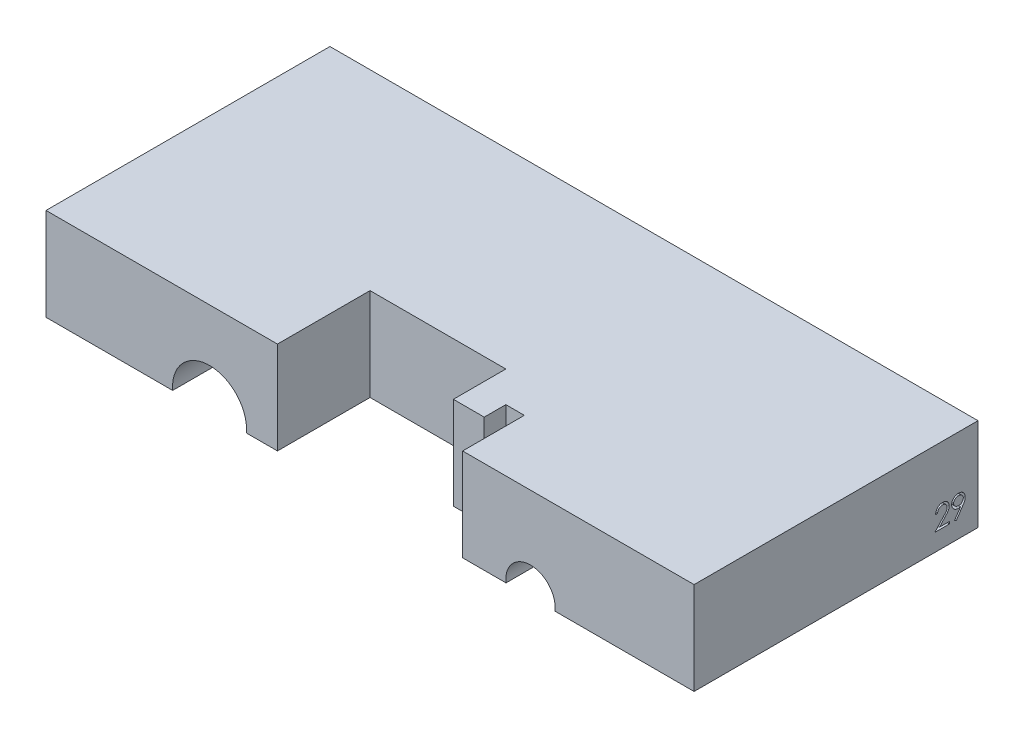
from build123d import *

# Parameters (mm, degrees)
SKETCH1_W               = 105
SKETCH1_H               = 92
BOSS_EXTRUDE1_DEPTH     = 15
SKETCH2_W               = 30
SKETCH2_H               = 30
CUT_EXTRUDE1_DEPTH      = 72
BOSS_EXTRUDE4_DEPTH     = 15
CUT_EXTRUDE2_DEPTH      = 84
CUT_EXTRUDE2_DEPTH_BACK = 64
SKETCH18_R              = 4
CUT_EXTRUDE3_DEPTH      = 10
CUT_EXTRUDE3_DEPTH_BACK = 10
SKETCH22_R              = 6
CUT_EXTRUDE4_DEPTH      = 10
CUT_EXTRUDE4_DEPTH_BACK = 10
SKETCH23_R              = 6
CUT_EXTRUDE5_DEPTH      = 10
CUT_EXTRUDE5_DEPTH_BACK = 10
SKETCH24_R              = 6
CUT_EXTRUDE7_DEPTH      = 2
CUT_EXTRUDE8_DEPTH      = 2
SKETCH30_W              = 105
SKETCH30_H              = 46
CUT_EXTRUDE10_DEPTH     = 40


with BuildPart() as part:
    # Sketch1 → Boss-Extrude1 (new body)
    with BuildSketch(Plane(origin=(0, 0, 0), x_dir=(1, 0, 0), z_dir=(0, 1, 0))):
        with Locations((52.5, 46)):
            Rectangle(SKETCH1_W, SKETCH1_H)
    extrude(amount=BOSS_EXTRUDE1_DEPTH)

    # Sketch2 → Cut-Extrude1 (cut)
    with BuildSketch(Plane(origin=(0, 15, 0), x_dir=(1, 0, 0), z_dir=(0, 1, 0))):
        with Locations((52.5, 46)):
            Rectangle(SKETCH2_W, SKETCH2_H)
    extrude(amount=-CUT_EXTRUDE1_DEPTH, mode=Mode.SUBTRACT)

    # Sketch15 → Boss-Extrude4 (add)
    with BuildSketch(Plane(origin=(0, 15, 0), x_dir=(1, 0, 0), z_dir=(0, 1, 0))):
        Polygon((72.5, 67), (72.5, 46), (72.5, 25), (59.5, 25), (59.5, 31), (59.5, 39.5), (64.5, 39.5), (64.5, 36), (67.5, 36), (67.5, 46), (67.5, 56), (64.5, 56), (64.5, 52.5), (59.5, 52.5), (59.5, 61), (59.5, 67), align=None)
    extrude(amount=-BOSS_EXTRUDE4_DEPTH)

    # Sketch18 → Cut-Extrude2 (cut, two sides: drawn at the far end of the back side and taken through both)
    with BuildSketch(Plane.XY.offset(-46).offset(-CUT_EXTRUDE2_DEPTH_BACK)):
        with Locations((26.5, 0.5)):
            Circle(SKETCH18_R)
        with Locations((78.5, 0.5)):
            Circle(SKETCH18_R)
    extrude(amount=CUT_EXTRUDE2_DEPTH + CUT_EXTRUDE2_DEPTH_BACK, mode=Mode.SUBTRACT)

    # Sketch22 → Cut-Extrude3 (cut, two sides: drawn at the far end of the back side and taken through both)
    with BuildSketch(Plane.XY.offset(-46).offset(-CUT_EXTRUDE3_DEPTH_BACK)):
        with Locations((26.5, 0.5)):
            Circle(SKETCH22_R)
    extrude(amount=CUT_EXTRUDE3_DEPTH + CUT_EXTRUDE3_DEPTH_BACK, mode=Mode.SUBTRACT)

    # Sketch23 → Cut-Extrude4 (cut, two sides: drawn at the far end of the back side and taken through both)
    with BuildSketch(Plane(origin=(0, 0, -69), x_dir=(-1, 0, 0), z_dir=(0, 0, -1)).offset(-CUT_EXTRUDE4_DEPTH_BACK)):
        with Locations((-78.5, 0.5)):
            Circle(SKETCH23_R)
    extrude(amount=CUT_EXTRUDE4_DEPTH + CUT_EXTRUDE4_DEPTH_BACK, mode=Mode.SUBTRACT)

    # Sketch24 → Cut-Extrude5 (cut, two sides: drawn at the far end of the back side and taken through both)
    with BuildSketch(Plane.XY.offset(-23).offset(-CUT_EXTRUDE5_DEPTH_BACK)):
        with Locations((78.5, 0.5)):
            Circle(SKETCH24_R)
    extrude(amount=CUT_EXTRUDE5_DEPTH + CUT_EXTRUDE5_DEPTH_BACK, mode=Mode.SUBTRACT)

    # Sketch27 → Cut-Extrude7 (cut)
    # profile 1 of 2: a face of its own
    with BuildSketch(Plane.ZY):
        with BuildLine():
            Line((-6.628929061, 4.581451926), (-6.943031625, 4.581451926))
            add(Edge.make_bspline(
                [(-6.943031625, 4.581451926), (-6.940984472, 4.623122814), (-6.936963918, 4.704963329), (-6.918135629, 4.824287235), (-6.891194752, 4.938342034), (-6.853103298, 5.046211948), (-6.80579702, 5.148850755), (-6.749066993, 5.245850771), (-6.681873142, 5.336841959), (-6.605666408, 5.420980803), (-6.522897769, 5.498168374), (-6.43359183, 5.564823616), (-6.339746802, 5.621141288), (-6.241647403, 5.66822253), (-6.13818684, 5.703562375), (-6.030303982, 5.729784015), (-5.917524846, 5.745560361), (-5.840684824, 5.747256146), (-5.801605343, 5.748118593)],
                knots=[0, 0, 0, 0, 1.10065271, 2.161652631, 3.183658789, 4.190468796, 5.17591951, 6.163126047, 7.15150782, 8.156236427, 9.156009102, 10.134482811, 11.092018607, 12.041330605, 13.001268258, 13.972401359, 14.968799086, 16, 16, 16, 16], degree=3))
            add(Edge.make_bspline(
                [(-5.801605343, 5.748118593), (-5.763227269, 5.747220137), (-5.687815725, 5.745454702), (-5.57775371, 5.730293673), (-5.472976416, 5.706548081), (-5.373688649, 5.673232665), (-5.280682585, 5.628448237), (-5.19325954, 5.574650699), (-5.110378729, 5.512430867), (-5.035771946, 5.439177054), (-4.967263866, 5.360974669), (-4.908161611, 5.277486766), (-4.857548448, 5.19125748), (-4.815360768, 5.101629278), (-4.784304629, 5.00775825), (-4.760726421, 4.911011047), (-4.747399007, 4.810386236), (-4.745353584, 4.74227968), (-4.744313677, 4.707653849)],
                knots=[0, 0, 0, 0, 1.111607364, 2.184268762, 3.212621178, 4.221274766, 5.211760367, 6.196651075, 7.1921475, 8.207485113, 9.220403448, 10.201281604, 11.166441695, 12.114753415, 13.065576456, 14.026450734, 14.996634279, 16, 16, 16, 16], degree=3))
            add(Edge.make_bspline(
                [(-4.744313677, 4.707653849), (-4.74600694, 4.658906015), (-4.749363751, 4.562265801), (-4.778078128, 4.420250938), (-4.822924639, 4.282657519), (-4.876921995, 4.171920217), (-4.93139444, 4.082686724), (-4.980481947, 4.009218019), (-5.037946758, 3.93011255), (-5.104625256, 3.845635213), (-5.179138128, 3.755124308), (-5.262160292, 3.658634512), (-5.354283774, 3.557162743), (-5.418942274, 3.487857141), (-5.45244669, 3.451944715)],
                knots=[0, 0, 0, 0, 1.184426356, 2.348067706, 3.509069118, 4.696110526, 5.333549288, 6.050745305, 6.844228056, 7.710549037, 8.667450064, 9.695053472, 10.805634456, 12, 12, 12, 12], degree=3))
            Line((-5.45244669, 3.451944715), (-6.328147811, 2.517349362))
            Line((-6.328147811, 2.517349362), (-4.699441882, 2.517349362))
            Line((-4.699441882, 2.517349362), (-4.699441882, 2.158375003))
            Line((-4.699441882, 2.158375003), (-7.07764701, 2.158375003))
            Line((-7.07764701, 2.158375003), (-5.720275215, 3.606892632))
            add(Edge.make_bspline(
                [(-5.720275215, 3.606892632), (-5.687227328, 3.641390938), (-5.623749101, 3.707655125), (-5.533966524, 3.804398085), (-5.453327536, 3.894147626), (-5.381310143, 3.976734174), (-5.319476638, 4.053365742), (-5.264604406, 4.121560445), (-5.220638815, 4.184314896), (-5.172923419, 4.25705551), (-5.126709438, 4.345867827), (-5.086997082, 4.454401516), (-5.062782234, 4.566128769), (-5.059877398, 4.641630806), (-5.058416241, 4.679608978)],
                knots=[0, 0, 0, 0, 1.329631726, 2.553950428, 3.673215718, 4.687767853, 5.603093632, 6.413772471, 7.123043292, 7.734684054, 8.834405432, 9.900288307, 10.943827018, 12, 12, 12, 12], degree=3))
            add(Edge.make_bspline(
                [(-5.058416241, 4.679608978), (-5.059051983, 4.703490376), (-5.060304909, 4.750556026), (-5.071362607, 4.819561785), (-5.088073113, 4.886126599), (-5.112018371, 4.950455218), (-5.143625111, 5.01190087), (-5.182098491, 5.070538351), (-5.226488554, 5.127227316), (-5.277839824, 5.180380614), (-5.334251343, 5.229061819), (-5.393845593, 5.272185905), (-5.456895697, 5.308225016), (-5.523135819, 5.337768513), (-5.592381289, 5.360943894), (-5.664766034, 5.377002473), (-5.74009005, 5.387084957), (-5.791523546, 5.388449129), (-5.817731145, 5.389144234)],
                knots=[0, 0, 0, 0, 0.991446411, 1.95395049, 2.89581595, 3.838931463, 4.798493298, 5.75982156, 6.748411868, 7.785213223, 8.824556874, 9.840280684, 10.836137867, 11.835679398, 12.848801643, 13.863922112, 14.911575587, 16, 16, 16, 16], degree=3))
            add(Edge.make_bspline(
                [(-5.817731145, 5.389144234), (-5.845101977, 5.388429202), (-5.898853774, 5.387024997), (-5.977772807, 5.377202333), (-6.053058584, 5.360256492), (-6.124900487, 5.337079818), (-6.193420073, 5.307621269), (-6.258284117, 5.270929524), (-6.319347006, 5.227146031), (-6.37672353, 5.177505475), (-6.429587509, 5.122237874), (-6.476034384, 5.06062791), (-6.516618399, 4.993800495), (-6.552027632, 4.921935945), (-6.580783322, 4.844382165), (-6.602756473, 4.76141446), (-6.620143319, 4.673393078), (-6.62595184, 4.612607993), (-6.628929061, 4.581451926)],
                knots=[0, 0, 0, 0, 1.031018746, 2.02475058, 2.990194455, 3.934040569, 4.864654155, 5.795059489, 6.735614925, 7.690564532, 8.649604399, 9.611025574, 10.590972636, 11.591080095, 12.624614302, 13.701020113, 14.821632451, 16, 16, 16, 16], degree=3))
        make_face()
    # profile 2 of 2: a face of its own
    with BuildSketch(Plane.ZY):
        with BuildLine():
            Line((-3.622518805, 2.068631414), (-3.873520408, 2.24321074))
            Line((-3.873520408, 2.24321074), (-2.900363356, 3.665786862))
            add(Edge.make_bspline(
                [(-2.900363356, 3.665786862), (-2.962454092, 3.658193799), (-3.084714212, 3.643242634), (-3.207851314, 3.640495979), (-3.268452299, 3.639144234)],
                knots=[0, 0, 0, 0, 1.015715272, 2, 2, 2, 2], degree=3))
            add(Edge.make_bspline(
                [(-3.268452299, 3.639144234), (-3.305194346, 3.640085311), (-3.377315773, 3.641932561), (-3.483347426, 3.65657437), (-3.585232986, 3.679124497), (-3.682702342, 3.712773252), (-3.776121847, 3.754591461), (-3.86528756, 3.806448475), (-3.950079451, 3.867454767), (-4.029586861, 3.937287758), (-4.1018986, 4.013965811), (-4.166321898, 4.095121454), (-4.21986303, 4.181697424), (-4.264339615, 4.271927644), (-4.298070068, 4.367108995), (-4.322632606, 4.466158395), (-4.33775496, 4.569770037), (-4.339554056, 4.640295168), (-4.340467523, 4.676103369)],
                knots=[0, 0, 0, 0, 1.060718605, 2.082097864, 3.085795603, 4.069760067, 5.054557537, 6.03741023, 7.043284206, 8.066802108, 9.088538119, 10.083643548, 11.053783639, 12.022749082, 12.983451788, 13.964007469, 14.966251758, 16, 16, 16, 16], degree=3))
            add(Edge.make_bspline(
                [(-4.340467523, 4.676103369), (-4.338733088, 4.725072021), (-4.335328744, 4.821187553), (-4.307930227, 4.961621322), (-4.262869888, 5.094407866), (-4.200041511, 5.21919806), (-4.12090679, 5.334196799), (-4.0257982, 5.437805408), (-3.915294235, 5.528550262), (-3.791912216, 5.606554339), (-3.658559195, 5.669289336), (-3.518890537, 5.715528637), (-3.373976417, 5.742727385), (-3.275808747, 5.746313246), (-3.226384991, 5.748118593)],
                knots=[0, 0, 0, 0, 1.022988612, 2.007919123, 2.978103895, 3.94594894, 4.918897164, 5.887013414, 6.875921846, 7.89917871, 8.930658928, 9.948724884, 10.967259574, 12, 12, 12, 12], degree=3))
            add(Edge.make_bspline(
                [(-3.226384991, 5.748118593), (-3.177896571, 5.74628843), (-3.082088024, 5.7426722), (-2.941199018, 5.716188231), (-2.806258001, 5.671551558), (-2.678013014, 5.609866995), (-2.559273602, 5.532546087), (-2.452497791, 5.440411563), (-2.360122252, 5.333406036), (-2.282298371, 5.214117546), (-2.219828331, 5.085950565), (-2.174756048, 4.952166642), (-2.147010409, 4.813727921), (-2.143514082, 4.719933447), (-2.141749574, 4.67259776)],
                knots=[0, 0, 0, 0, 1.026385292, 2.028040595, 3.023318987, 4.028184125, 5.03290303, 6.015178782, 7.004435299, 8.016004309, 9.023023918, 10.015172535, 10.998308025, 12, 12, 12, 12], degree=3))
            add(Edge.make_bspline(
                [(-2.141749574, 4.67259776), (-2.142927983, 4.635853993), (-2.145318091, 4.561328452), (-2.162054398, 4.448098109), (-2.190474583, 4.33264688), (-2.222726282, 4.234925284), (-2.25385845, 4.154216834), (-2.283159581, 4.090465254), (-2.315671735, 4.023363991), (-2.3535905, 3.953616653), (-2.394352797, 3.880334118), (-2.440412074, 3.804251402), (-2.490717645, 3.725266409), (-2.526547365, 3.672019321), (-2.544894606, 3.644753208)],
                knots=[0, 0, 0, 0, 1.179839688, 2.393009684, 3.667231171, 4.993948276, 5.694988576, 6.444077775, 7.246288328, 8.089075292, 8.993003841, 9.939041771, 10.944649915, 12, 12, 12, 12], degree=3))
            Line((-2.544894606, 3.644753208), (-3.622518805, 2.068631414))
        make_face()
        with BuildLine():
            add(Edge.make_bspline(
                [(-3.21025919, 3.998118593), (-3.182425175, 3.998878977), (-3.128241812, 4.000359186), (-3.048864513, 4.009368427), (-2.97394031, 4.025342414), (-2.903269061, 4.048262126), (-2.836142159, 4.075918794), (-2.773625831, 4.111130781), (-2.715667755, 4.153147415), (-2.661879828, 4.200357431), (-2.614115829, 4.252808015), (-2.571572798, 4.307705121), (-2.53541223, 4.365289731), (-2.506848953, 4.426282994), (-2.483364378, 4.489200202), (-2.467146366, 4.555054557), (-2.458162033, 4.623502958), (-2.456630458, 4.670001616), (-2.455852138, 4.693631414)],
                knots=[0, 0, 0, 0, 1.163407946, 2.26475976, 3.333800367, 4.359385343, 5.366239384, 6.363380779, 7.350133999, 8.353570782, 9.349036268, 10.310270964, 11.253520213, 12.184142, 13.120487599, 14.056272588, 15.012232024, 16, 16, 16, 16], degree=3))
            add(Edge.make_bspline(
                [(-2.455852138, 4.693631414), (-2.456521807, 4.717271079), (-2.457841473, 4.763855939), (-2.468428772, 4.832405679), (-2.487053996, 4.898098939), (-2.51204448, 4.961295369), (-2.544964718, 5.021475741), (-2.584468204, 5.079395613), (-2.631400654, 5.134687741), (-2.68540322, 5.186051724), (-2.743637773, 5.233399624), (-2.805698273, 5.2751857), (-2.871073189, 5.310206896), (-2.939363679, 5.339105866), (-3.010712028, 5.361657642), (-3.085076016, 5.377875006), (-3.162831422, 5.386846761), (-3.215612708, 5.388368655), (-3.242510792, 5.389144234)],
                knots=[0, 0, 0, 0, 0.972161553, 1.915763587, 2.844109794, 3.775983486, 4.705125789, 5.659731448, 6.655561913, 7.682237399, 8.721216875, 9.739758359, 10.754845918, 11.767244016, 12.7857855, 13.828538656, 14.893392813, 16, 16, 16, 16], degree=3))
            add(Edge.make_bspline(
                [(-3.242510792, 5.389144234), (-3.269174946, 5.388367402), (-3.321489795, 5.386843265), (-3.398553954, 5.37789206), (-3.472415122, 5.361548576), (-3.543556742, 5.339116312), (-3.611845203, 5.31020474), (-3.677217036, 5.275183865), (-3.739292052, 5.233409242), (-3.797470773, 5.18601447), (-3.851568695, 5.134926824), (-3.897694224, 5.079153395), (-3.937288116, 5.02150587), (-3.970163119, 4.961287362), (-3.995165636, 4.898101077), (-4.013787638, 4.8324051), (-4.024375803, 4.76385609), (-4.02569535, 4.71727113), (-4.026364959, 4.693631414)],
                knots=[0, 0, 0, 0, 1.099389452, 2.15699305, 3.192601482, 4.213358962, 5.227959689, 6.245255729, 7.266013209, 8.307253147, 9.336162325, 10.327954924, 11.284637477, 12.215801273, 13.149702402, 14.080068371, 15.025723358, 16, 16, 16, 16], degree=3))
            add(Edge.make_bspline(
                [(-4.026364959, 4.693631414), (-4.025759033, 4.669983215), (-4.024564036, 4.623344639), (-4.013036246, 4.554818246), (-3.993757966, 4.489130052), (-3.967938575, 4.425641345), (-3.933936985, 4.364969487), (-3.892213137, 4.307402125), (-3.843307591, 4.252286675), (-3.787874104, 4.200479463), (-3.727205943, 4.152927287), (-3.662409196, 4.111396905), (-3.59459936, 4.076324461), (-3.523537729, 4.048183077), (-3.449750929, 4.025571413), (-3.372575798, 4.009397868), (-3.29226756, 4.000445601), (-3.237857578, 3.998901704), (-3.21025919, 3.998118593)],
                knots=[0, 0, 0, 0, 0.952633368, 1.87876736, 2.791047057, 3.707742249, 4.635551637, 5.587206343, 6.568248508, 7.601284464, 8.641511608, 9.671105535, 10.699146789, 11.713763218, 12.747829548, 13.806491675, 14.887386225, 16, 16, 16, 16], degree=3))
        make_face(mode=Mode.SUBTRACT)
    extrude(amount=-CUT_EXTRUDE7_DEPTH, mode=Mode.SUBTRACT)

    # Sketch28 → Cut-Extrude8 (cut)
    # profile 1 of 2: a face of its own
    with BuildSketch(Plane(origin=(105, 0, 0), x_dir=(0, 0, -1), z_dir=(1, 0, 0))):
        with BuildLine():
            Line((85.444393694, 5.241356725), (85.13029113, 5.241356725))
            add(Edge.make_bspline(
                [(85.13029113, 5.241356725), (85.132338283, 5.283027613), (85.136358837, 5.364868127), (85.155187126, 5.484192034), (85.182128003, 5.598246832), (85.220219457, 5.706116746), (85.267525735, 5.808755554), (85.324255763, 5.905755569), (85.391449613, 5.996746758), (85.467656347, 6.080885601), (85.550424986, 6.158073172), (85.639730926, 6.224728415), (85.733575953, 6.281046086), (85.831675352, 6.328127328), (85.935135915, 6.363467174), (86.043018773, 6.389688814), (86.15579791, 6.405465159), (86.232637932, 6.407160945), (86.271717412, 6.408023392)],
                knots=[0, 0, 0, 0, 1.10065271, 2.161652631, 3.183658789, 4.190468796, 5.17591951, 6.163126047, 7.15150782, 8.156236427, 9.156009102, 10.134482811, 11.092018607, 12.041330605, 13.001268258, 13.972401359, 14.968799086, 16, 16, 16, 16], degree=3))
            add(Edge.make_bspline(
                [(86.271717412, 6.408023392), (86.310095486, 6.407124935), (86.385507031, 6.4053595), (86.495569045, 6.390198471), (86.60034634, 6.366452879), (86.699634106, 6.333137463), (86.792640171, 6.288353036), (86.880063215, 6.234555497), (86.962944026, 6.172335666), (87.03755081, 6.099081852), (87.106058889, 6.020879468), (87.165161144, 5.937391564), (87.215774308, 5.851162278), (87.257961987, 5.761534077), (87.289018126, 5.667663048), (87.312596334, 5.570915846), (87.325923748, 5.470291035), (87.327969172, 5.402184479), (87.329009079, 5.367558648)],
                knots=[0, 0, 0, 0, 1.111607364, 2.184268762, 3.212621178, 4.221274766, 5.211760367, 6.196651075, 7.1921475, 8.207485113, 9.220403448, 10.201281604, 11.166441695, 12.114753415, 13.065576456, 14.026450734, 14.996634279, 16, 16, 16, 16], degree=3))
            add(Edge.make_bspline(
                [(87.329009079, 5.367558648), (87.327315816, 5.318810813), (87.323959004, 5.2221706), (87.295244628, 5.080155737), (87.250398117, 4.942562318), (87.19640076, 4.831825016), (87.141928316, 4.742591522), (87.092840808, 4.669122817), (87.035375997, 4.590017349), (86.968697499, 4.505540011), (86.894184627, 4.415029106), (86.811162464, 4.318539311), (86.719038982, 4.217067541), (86.654380481, 4.14776194), (86.620876066, 4.111849513)],
                knots=[0, 0, 0, 0, 1.184426356, 2.348067706, 3.509069118, 4.696110526, 5.333549288, 6.050745305, 6.844228056, 7.710549037, 8.667450064, 9.695053472, 10.805634456, 12, 12, 12, 12], degree=3))
            Line((86.620876066, 4.111849513), (85.745174944, 3.177254161))
            Line((85.745174944, 3.177254161), (87.373880874, 3.177254161))
            Line((87.373880874, 3.177254161), (87.373880874, 2.818279802))
            Line((87.373880874, 2.818279802), (84.995675745, 2.818279802))
            Line((84.995675745, 2.818279802), (86.35304754, 4.26679743))
            add(Edge.make_bspline(
                [(86.35304754, 4.26679743), (86.386095427, 4.301295737), (86.449573654, 4.367559923), (86.539356231, 4.464302883), (86.619995219, 4.554052424), (86.692012612, 4.636638973), (86.753846117, 4.71327054), (86.808718349, 4.781465244), (86.85268394, 4.844219694), (86.900399336, 4.916960308), (86.946613317, 5.005772625), (86.986325673, 5.114306315), (87.010540522, 5.226033567), (87.013445357, 5.301535604), (87.014906515, 5.339513776)],
                knots=[0, 0, 0, 0, 1.329631726, 2.553950428, 3.673215718, 4.687767853, 5.603093632, 6.413772471, 7.123043292, 7.734684054, 8.834405432, 9.900288307, 10.943827018, 12, 12, 12, 12], degree=3))
            add(Edge.make_bspline(
                [(87.014906515, 5.339513776), (87.014270772, 5.363395175), (87.013017846, 5.410460825), (87.001960149, 5.479466584), (86.985249643, 5.546031398), (86.961304385, 5.610360017), (86.929697645, 5.671805669), (86.891224265, 5.730443149), (86.846834201, 5.787132114), (86.795482932, 5.840285412), (86.739071412, 5.888966618), (86.679477162, 5.932090703), (86.616427058, 5.968129814), (86.550186936, 5.997673311), (86.480941467, 6.020848693), (86.408556721, 6.036907272), (86.333232705, 6.046989756), (86.28179921, 6.048353928), (86.255591611, 6.049049033)],
                knots=[0, 0, 0, 0, 0.991446411, 1.95395049, 2.89581595, 3.838931463, 4.798493298, 5.75982156, 6.748411868, 7.785213223, 8.824556874, 9.840280684, 10.836137867, 11.835679398, 12.848801643, 13.863922112, 14.911575587, 16, 16, 16, 16], degree=3))
            add(Edge.make_bspline(
                [(86.255591611, 6.049049033), (86.228220778, 6.048334), (86.174468982, 6.046929795), (86.095549949, 6.037107131), (86.020264171, 6.020161291), (85.948422268, 5.996984616), (85.879902682, 5.967526067), (85.815038638, 5.930834323), (85.753975749, 5.88705083), (85.696599226, 5.837410273), (85.643735247, 5.782142672), (85.597288371, 5.720532709), (85.556704357, 5.653705294), (85.521295123, 5.581840743), (85.492539433, 5.504286963), (85.470566283, 5.421319258), (85.453179436, 5.333297877), (85.447370915, 5.272512792), (85.444393694, 5.241356725)],
                knots=[0, 0, 0, 0, 1.031018746, 2.02475058, 2.990194455, 3.934040569, 4.864654155, 5.795059489, 6.735614925, 7.690564532, 8.649604399, 9.611025574, 10.590972636, 11.591080095, 12.624614302, 13.701020113, 14.821632451, 16, 16, 16, 16], degree=3))
        make_face()
    # profile 2 of 2: a face of its own
    with BuildSketch(Plane(origin=(105, 0, 0), x_dir=(0, 0, -1), z_dir=(1, 0, 0))):
        with BuildLine():
            Line((88.45080395, 2.728536212), (88.199802348, 2.903115539))
            Line((88.199802348, 2.903115539), (89.172959399, 4.325691661))
            add(Edge.make_bspline(
                [(89.172959399, 4.325691661), (89.110868664, 4.318098598), (88.988608543, 4.303147433), (88.865471441, 4.300400778), (88.804870457, 4.299049033)],
                knots=[0, 0, 0, 0, 1.015715272, 2, 2, 2, 2], degree=3))
            add(Edge.make_bspline(
                [(88.804870457, 4.299049033), (88.768128409, 4.299990109), (88.696006982, 4.30183736), (88.58997533, 4.316479168), (88.488089769, 4.339029296), (88.390620413, 4.372678051), (88.297200908, 4.41449626), (88.208035195, 4.466353274), (88.123243304, 4.527359565), (88.043735894, 4.597192557), (87.971424156, 4.673870609), (87.907000858, 4.755026252), (87.853459726, 4.841602223), (87.80898314, 4.931832442), (87.775252687, 5.027013793), (87.750690149, 5.126063193), (87.735567795, 5.229674835), (87.733768699, 5.300199966), (87.732855232, 5.336008167)],
                knots=[0, 0, 0, 0, 1.060718605, 2.082097864, 3.085795603, 4.069760067, 5.054557537, 6.03741023, 7.043284206, 8.066802108, 9.088538119, 10.083643548, 11.053783639, 12.022749082, 12.983451788, 13.964007469, 14.966251758, 16, 16, 16, 16], degree=3))
            add(Edge.make_bspline(
                [(87.732855232, 5.336008167), (87.734589667, 5.38497682), (87.737994011, 5.481092352), (87.765392528, 5.621526121), (87.810452867, 5.754312664), (87.873281244, 5.879102858), (87.952415966, 5.994101597), (88.047524556, 6.097710206), (88.15802852, 6.18845506), (88.281410539, 6.266459138), (88.41476356, 6.329194135), (88.554432218, 6.375433435), (88.699346338, 6.402632183), (88.797514008, 6.406218044), (88.846937765, 6.408023392)],
                knots=[0, 0, 0, 0, 1.022988612, 2.007919123, 2.978103895, 3.94594894, 4.918897164, 5.887013414, 6.875921846, 7.89917871, 8.930658928, 9.948724884, 10.967259574, 12, 12, 12, 12], degree=3))
            add(Edge.make_bspline(
                [(88.846937765, 6.408023392), (88.895426184, 6.406193229), (88.991234731, 6.402576999), (89.132123738, 6.37609303), (89.267064754, 6.331456357), (89.395309741, 6.269771793), (89.514049153, 6.192450886), (89.620824965, 6.100316362), (89.713200504, 5.993310835), (89.791024384, 5.874022345), (89.853494425, 5.745855363), (89.898566708, 5.612071441), (89.926312347, 5.47363272), (89.929808674, 5.379838245), (89.931573181, 5.332502558)],
                knots=[0, 0, 0, 0, 1.026385292, 2.028040595, 3.023318987, 4.028184125, 5.03290303, 6.015178782, 7.004435299, 8.016004309, 9.023023918, 10.015172535, 10.998308025, 12, 12, 12, 12], degree=3))
            add(Edge.make_bspline(
                [(89.931573181, 5.332502558), (89.930394772, 5.295758791), (89.928004665, 5.22123325), (89.911268357, 5.108002908), (89.882848172, 4.992551678), (89.850596474, 4.894830082), (89.819464306, 4.814121633), (89.790163174, 4.750370053), (89.757651021, 4.683268789), (89.719732255, 4.613521451), (89.678969958, 4.540238916), (89.632910682, 4.464156201), (89.58260511, 4.385171208), (89.54677539, 4.331924119), (89.528428149, 4.304658007)],
                knots=[0, 0, 0, 0, 1.179839688, 2.393009684, 3.667231171, 4.993948276, 5.694988576, 6.444077775, 7.246288328, 8.089075292, 8.993003841, 9.939041771, 10.944649915, 12, 12, 12, 12], degree=3))
            Line((89.528428149, 4.304658007), (88.45080395, 2.728536212))
        make_face()
        with BuildLine():
            add(Edge.make_bspline(
                [(88.863063566, 4.658023392), (88.89089758, 4.658783775), (88.945080943, 4.660263984), (89.024458242, 4.669273226), (89.099382445, 4.685247212), (89.170053695, 4.708166924), (89.237180597, 4.735823593), (89.299696925, 4.771035579), (89.357655, 4.813052214), (89.411442927, 4.86026223), (89.459206927, 4.912712813), (89.501749958, 4.96760992), (89.537910525, 5.02519453), (89.566473802, 5.086187792), (89.589958378, 5.149105001), (89.60617639, 5.214959356), (89.615160723, 5.283407757), (89.616692298, 5.329906415), (89.617470617, 5.353536212)],
                knots=[0, 0, 0, 0, 1.163407946, 2.26475976, 3.333800367, 4.359385343, 5.366239384, 6.363380779, 7.350133999, 8.353570782, 9.349036268, 10.310270964, 11.253520213, 12.184142, 13.120487599, 14.056272588, 15.012232024, 16, 16, 16, 16], degree=3))
            add(Edge.make_bspline(
                [(89.617470617, 5.353536212), (89.616800948, 5.377175877), (89.615481283, 5.423760737), (89.604893983, 5.492310477), (89.58626876, 5.558003738), (89.561278275, 5.621200168), (89.528358037, 5.68138054), (89.488854552, 5.739300412), (89.441922102, 5.794592539), (89.387919536, 5.845956523), (89.329684983, 5.893304422), (89.267624482, 5.935090498), (89.202249566, 5.970111695), (89.133959077, 5.999010664), (89.062610728, 6.02156244), (88.988246739, 6.037779805), (88.910491334, 6.046751559), (88.857710048, 6.048273454), (88.830811963, 6.049049033)],
                knots=[0, 0, 0, 0, 0.972161553, 1.915763587, 2.844109794, 3.775983486, 4.705125789, 5.659731448, 6.655561913, 7.682237399, 8.721216875, 9.739758359, 10.754845918, 11.767244016, 12.7857855, 13.828538656, 14.893392813, 16, 16, 16, 16], degree=3))
            add(Edge.make_bspline(
                [(88.830811963, 6.049049033), (88.80414781, 6.048272201), (88.751832961, 6.046748064), (88.674768801, 6.037796858), (88.600907633, 6.021453374), (88.529766013, 5.99902111), (88.461477552, 5.970109539), (88.39610572, 5.935088663), (88.334030703, 5.893314041), (88.275851982, 5.845919268), (88.22175406, 5.794831622), (88.175628531, 5.739058193), (88.136034639, 5.681410669), (88.103159636, 5.621192161), (88.078157119, 5.558005875), (88.059535117, 5.492309898), (88.048946952, 5.423760888), (88.047627406, 5.377175928), (88.046957797, 5.353536212)],
                knots=[0, 0, 0, 0, 1.099389452, 2.15699305, 3.192601482, 4.213358962, 5.227959689, 6.245255729, 7.266013209, 8.307253147, 9.336162325, 10.327954924, 11.284637477, 12.215801273, 13.149702402, 14.080068371, 15.025723358, 16, 16, 16, 16], degree=3))
            add(Edge.make_bspline(
                [(88.046957797, 5.353536212), (88.047563723, 5.329888013), (88.04875872, 5.283249437), (88.06028651, 5.214723044), (88.079564789, 5.14903485), (88.10538418, 5.085546143), (88.13938577, 5.024874285), (88.181109618, 4.967306923), (88.230015164, 4.912191473), (88.285448652, 4.860384261), (88.346116813, 4.812832086), (88.410913559, 4.771301704), (88.478723396, 4.736229259), (88.549785027, 4.708087875), (88.623571826, 4.685476212), (88.700746958, 4.669302667), (88.781055195, 4.6603504), (88.835465177, 4.658806503), (88.863063566, 4.658023392)],
                knots=[0, 0, 0, 0, 0.952633368, 1.87876736, 2.791047057, 3.707742249, 4.635551637, 5.587206343, 6.568248508, 7.601284464, 8.641511608, 9.671105535, 10.699146789, 11.713763218, 12.747829548, 13.806491675, 14.887386225, 16, 16, 16, 16], degree=3))
        make_face(mode=Mode.SUBTRACT)
    extrude(amount=-CUT_EXTRUDE8_DEPTH, mode=Mode.SUBTRACT)

    # Sketch30 → Cut-Extrude10 (cut)
    with BuildSketch(Plane.XZ):
        with Locations((52.5, -23)):
            Rectangle(SKETCH30_W, SKETCH30_H)
    extrude(amount=-CUT_EXTRUDE10_DEPTH, mode=Mode.SUBTRACT)


solid = part.part
